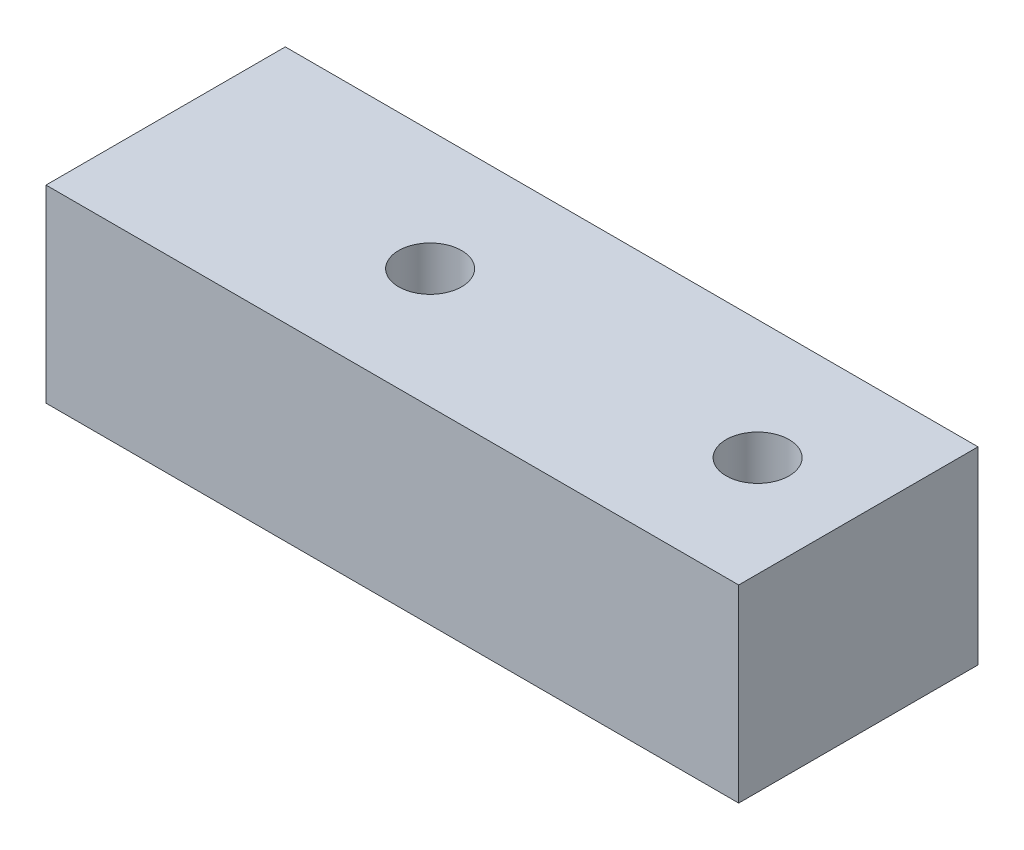
from build123d import *

# Parameters (mm, degrees)
SKETCH1_W           = 55
SKETCH1_H           = 19
BOSS_EXTRUDE1_DEPTH = 15
SKETCH2_R           = 2.5
CUT_EXTRUDE1_DEPTH  = 38.464322822


with BuildPart() as part:
    # Sketch1 → Boss-Extrude1 (new body)
    with BuildSketch(Plane(origin=(0, 0, 0), x_dir=(1, 0, 0), z_dir=(0, 1, 0))):
        with Locations((4.673687672, 2.47619748)):
            Rectangle(SKETCH1_W, SKETCH1_H)
    extrude(amount=BOSS_EXTRUDE1_DEPTH)

    # Sketch2 → Cut-Extrude1 (cut, through all)
    with BuildSketch(Plane(origin=(0, 15, 0), x_dir=(1, 0, 0), z_dir=(0, 1, 0))):
        with Locations(Location((24.173687672, 2.47619748, 0), (0, 0, 270))):
            Circle(SKETCH2_R)
        with Locations(Location((-1.826312328, 2.47619748, 0), (0, 0, 270))):
            Circle(SKETCH2_R)
    extrude(amount=-CUT_EXTRUDE1_DEPTH, mode=Mode.SUBTRACT)


solid = part.part
